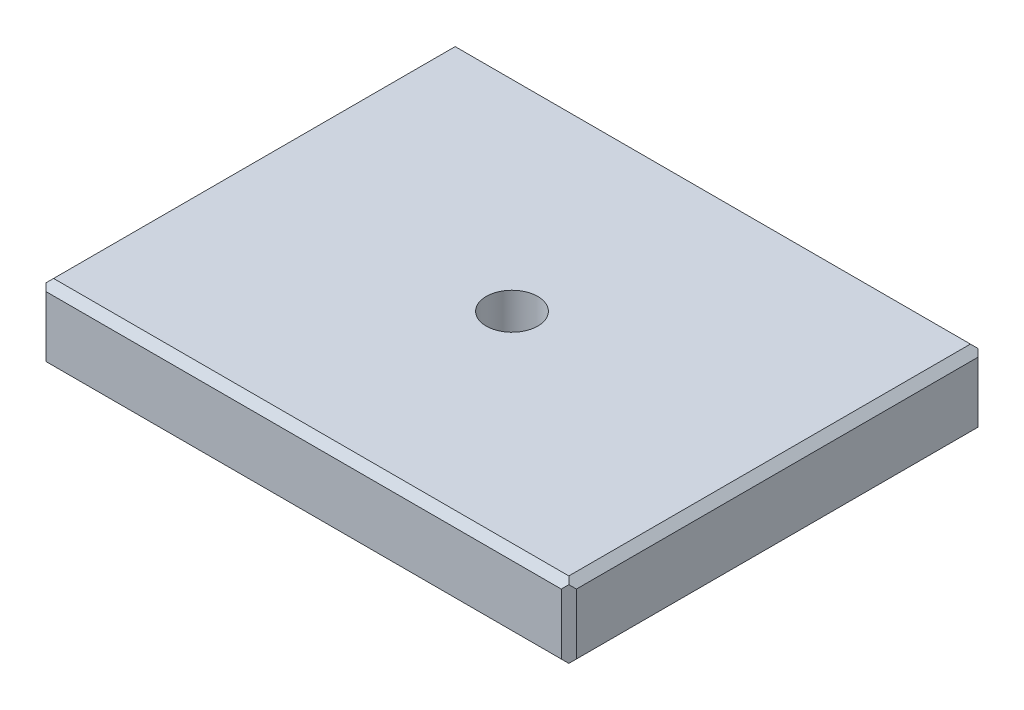
from build123d import *

# Parameters (mm, degrees)
SKETCH1_W           = 70
SKETCH1_H           = 55
BOSS_EXTRUDE1_DEPTH = 10
CHAMFER1_SIZE       = 1
M8_TAPPED_HOLE1_D   = 6.8
CHAMFER3_SIZE       = 1


with BuildPart() as part:
    # Sketch1 → Boss-Extrude1 (new body)
    with BuildSketch(Plane(origin=(0, 0, 0), x_dir=(1, 0, 0), z_dir=(0, 1, 0))):
        Rectangle(SKETCH1_W, SKETCH1_H)
    extrude(amount=-BOSS_EXTRUDE1_DEPTH)

    # Chamfer1
    chamfer1_edges = [part.edges().sort_by_distance(p)[0] for p in [
        (-35, -10, 0),
        (0, -10, 27.5),
        (35, -10, 0),
        (0, 0, 27.5),
        (-35, 0, 0),
        (0, 0, -27.5),
        (35, 0, 0),
        (0, -10, -27.5),
    ]]
    chamfer(chamfer1_edges, length=CHAMFER1_SIZE)

    # M8 Tapped Hole1 (through all)
    with Locations(Plane(origin=(0, 0, 0), x_dir=(1, 0, 0), z_dir=(0, 1, 0))):
        with Locations((0, 0)):
            Hole(M8_TAPPED_HOLE1_D / 2)

    # Chamfer3
    chamfer3_edges = [part.edges().sort_by_distance(p)[0] for p in [
        (35, -5, -27.5),
        (-35, -5, -27.5),
        (-35, -5, 27.5),
        (35, -5, 27.5),
    ]]
    chamfer(chamfer3_edges, length=CHAMFER3_SIZE)


solid = part.part
